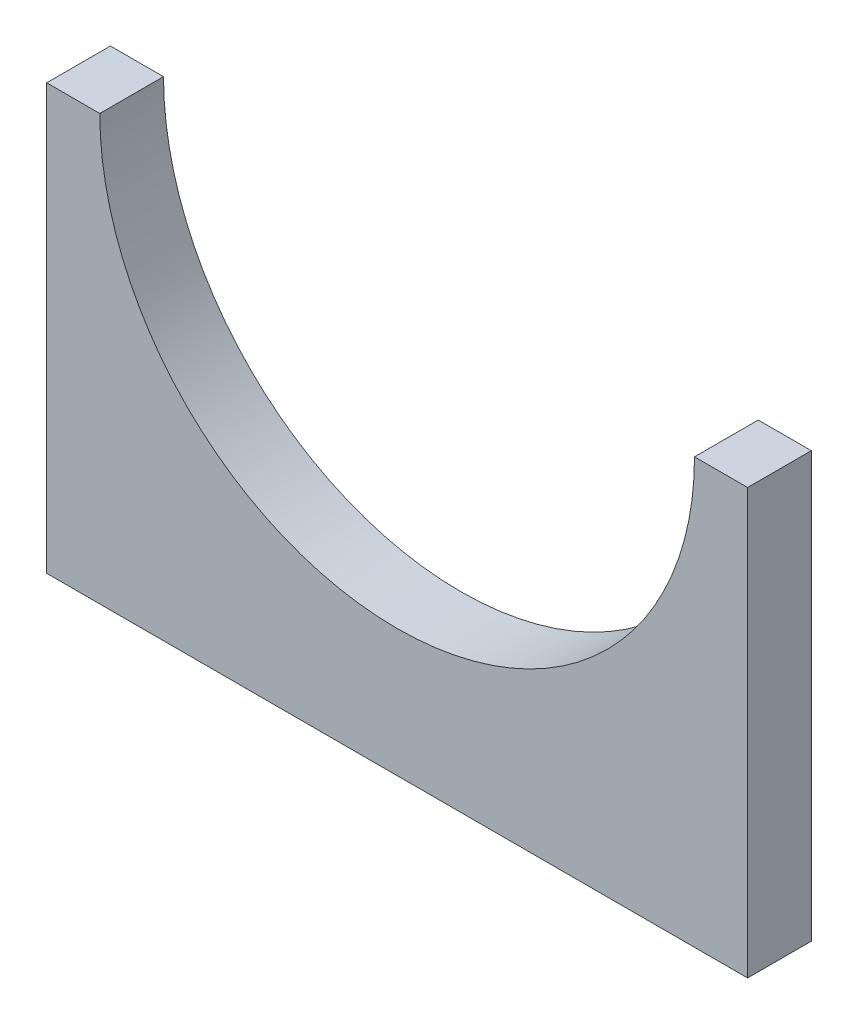
from build123d import *

# Parameters (mm, degrees)
BOSS_EXTRUDE1_DEPTH = 1.5


with BuildPart() as part:
    # Sketch1 → Boss-Extrude1 (new, symmetric)
    with BuildSketch(Plane.XY):
        with BuildLine():
            Line((-16.5, 0), (-14, 0))
            ThreePointArc((-14, 0), (0, -14), (14, 0))
            Line((14, 0), (16.5, 0))
            Line((16.5, 0), (16.5, -20))
            Line((16.5, -20), (-16.5, -20))
            Line((-16.5, -20), (-16.5, 0))
        make_face()
    extrude(amount=BOSS_EXTRUDE1_DEPTH, both=True)


solid = part.part
